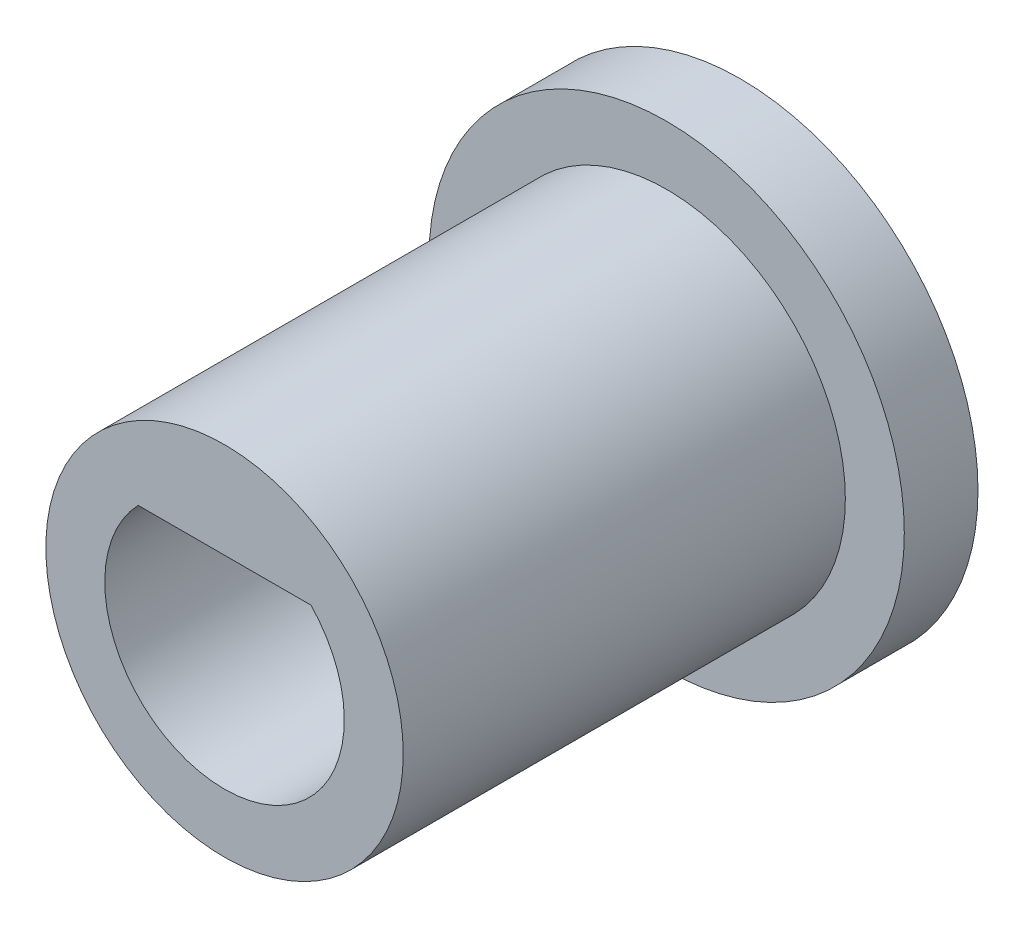
from build123d import *

# Parameters (mm, degrees)
SKETCH1_R           = 2.425
BOSS_EXTRUDE1_DEPTH = 6
BOSS_EXTRUDE2_START = -1
SKETCH1_4_R         = 3.225
BOSS_EXTRUDE2_DEPTH = 1


with BuildPart() as part:
    # Sketch1 → Boss-Extrude1 (new body)
    with BuildSketch(Plane.XY):
        Circle(SKETCH1_R)
        with BuildLine():
            Line((-1.17260394, 1.125), (1.17260394, 1.125))
            ThreePointArc((1.17260394, 1.125), (0, -1.625), (-1.17260394, 1.125))
        make_face(mode=Mode.SUBTRACT)
    extrude(amount=BOSS_EXTRUDE1_DEPTH)

    # Sketch1<4> → Boss-Extrude2 (add)
    with BuildSketch(Plane.XY.offset(BOSS_EXTRUDE2_START)):
        Circle(SKETCH1_4_R)
        with BuildLine():
            Line((-1.17260394, 1.125), (1.17260394, 1.125))
            ThreePointArc((1.17260394, 1.125), (0, -1.625), (-1.17260394, 1.125))
        make_face(mode=Mode.SUBTRACT)
    extrude(amount=BOSS_EXTRUDE2_DEPTH)


solid = part.part
